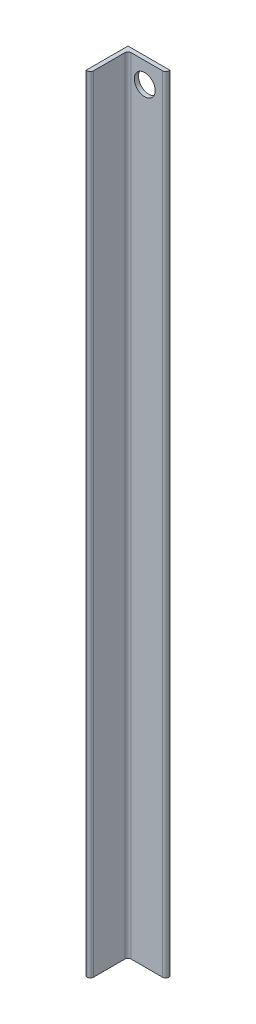
from build123d import *

# Parameters (mm, degrees)
BOSS_EXTRUDE1_DEPTH = 750
SKETCH2_R           = 10
CUT_EXTRUDE1_DEPTH  = 754.891393199


with BuildPart() as part:
    # Sketch1 → Boss-Extrude1 (new body)
    with BuildSketch(Plane(origin=(0, 0, 0), x_dir=(1, 0, 0), z_dir=(0, 1, 0))):
        with BuildLine():
            Line((-27.499872145, 29.213153277), (-67.499872145, 29.213153277))
            Line((-67.499872145, 29.213153277), (-67.499872145, -10.786846723))
            Line((-67.499872145, -10.786846723), (-66.499872145, -10.786846723))
            ThreePointArc((-66.499872145, -10.786846723), (-64.378551801, -9.908167067), (-63.499872145, -7.786846723))
            Line((-63.499872145, -7.786846723), (-63.499872145, 22.213153277))
            ThreePointArc((-63.499872145, 22.213153277), (-62.621192489, 24.334473621), (-60.499872145, 25.213153277))
            Line((-60.499872145, 25.213153277), (-30.499872145, 25.213153277))
            ThreePointArc((-30.499872145, 25.213153277), (-28.378551801, 26.091832933), (-27.499872145, 28.213153277))
            Line((-27.499872145, 28.213153277), (-27.499872145, 29.213153277))
        make_face()
    extrude(amount=BOSS_EXTRUDE1_DEPTH)

    # Sketch2 → Cut-Extrude1 (cut, through all)
    with BuildSketch(Plane.XY.offset(-25.213153277)):
        with Locations((-47.499872145, 730)):
            Circle(SKETCH2_R)
    extrude(amount=-CUT_EXTRUDE1_DEPTH, mode=Mode.SUBTRACT)


solid = part.part
